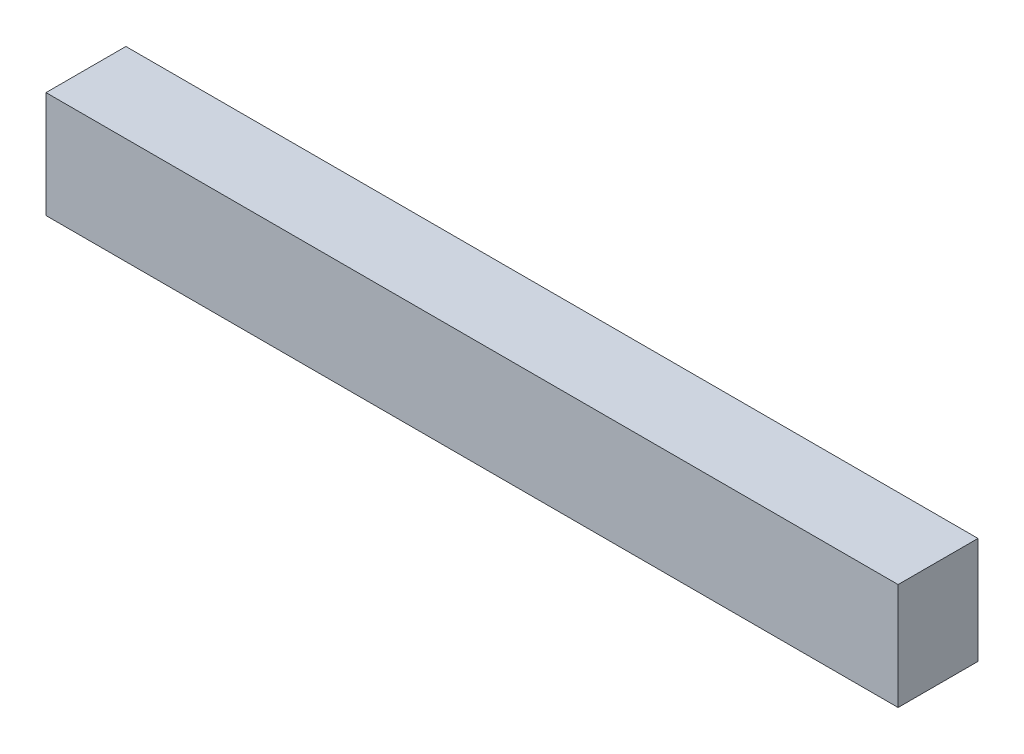
from build123d import *

# Parameters (mm, degrees)
SKETCH1_W           = 32
SKETCH1_H           = 3
BOSS_EXTRUDE1_DEPTH = 4


with BuildPart() as part:
    # Sketch1 → Boss-Extrude1 (new body)
    with BuildSketch(Plane(origin=(0, 0, 0), x_dir=(1, 0, 0), z_dir=(0, 1, 0))):
        with Locations((16, 1.5)):
            Rectangle(SKETCH1_W, SKETCH1_H)
    extrude(amount=BOSS_EXTRUDE1_DEPTH)


solid = part.part
